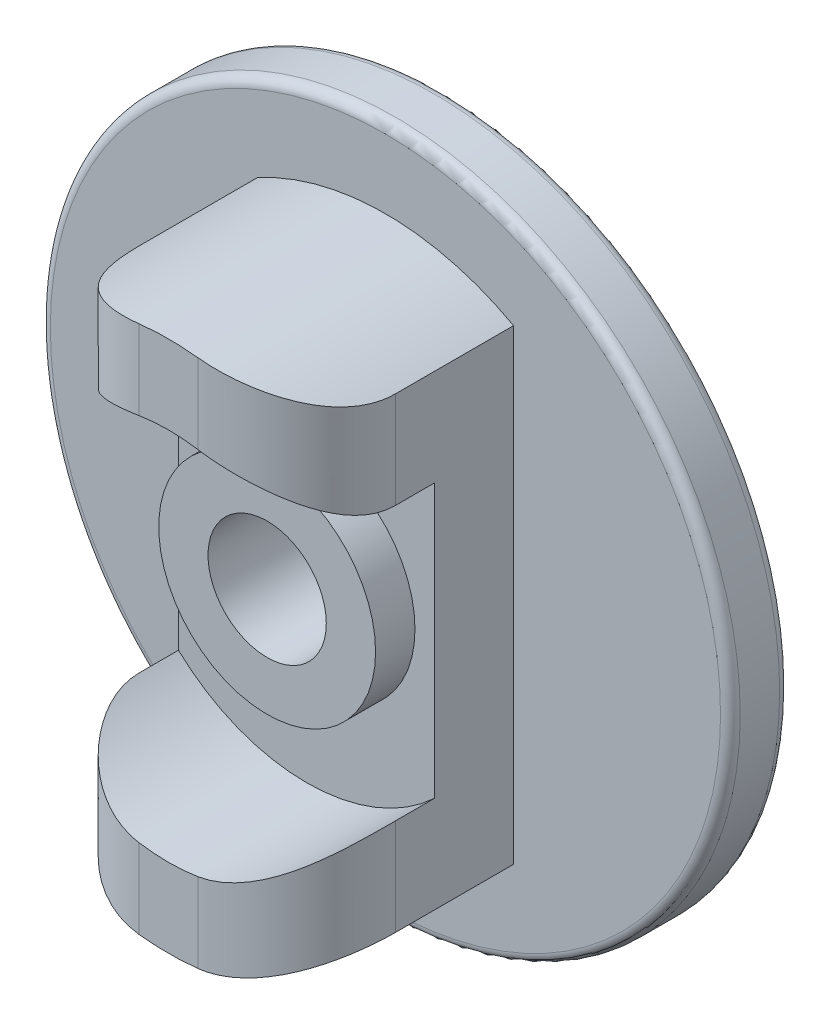
from build123d import *

# Parameters (mm, degrees)
SKETCH1_R           = 17.5
BOSS_EXTRUDE1_DEPTH = 3
SKETCH2_R           = 15.5
CUT_EXTRUDE1_DEPTH  = 1
SKETCH3_W           = 13
SKETCH3_H           = 28
BOSS_EXTRUDE2_DEPTH = 11
SKETCH4_R           = 9.5
CUT_EXTRUDE2_DEPTH  = 7
SKETCH5_R           = 16.54214052
SKETCH5_R_2         = 13.5
CUT_EXTRUDE3_DEPTH  = 11
FILLET1_R           = 5
SKETCH6_R           = 5.5
BOSS_EXTRUDE3_DEPTH = 2
SKETCH7_R           = 3
CUT_EXTRUDE4_DEPTH  = 27.334388165
FILLET3_R           = 0.5


with BuildPart() as part:
    # Sketch1 → Boss-Extrude1 (new body)
    with BuildSketch(Plane.XY):
        Circle(SKETCH1_R)
    extrude(amount=BOSS_EXTRUDE1_DEPTH)

    # Sketch2 → Cut-Extrude1 (cut)
    with BuildSketch(Plane(origin=(0, 0, 0), x_dir=(-1, 0, 0), z_dir=(0, 0, -1))):
        Circle(SKETCH2_R)
    extrude(amount=-CUT_EXTRUDE1_DEPTH, mode=Mode.SUBTRACT)

    # Sketch3 → Boss-Extrude2 (add)
    with BuildSketch(Plane.XY.offset(3)):
        Rectangle(SKETCH3_W, SKETCH3_H)
    extrude(amount=BOSS_EXTRUDE2_DEPTH)

    # Sketch4 → Cut-Extrude2 (cut)
    with BuildSketch(Plane.XY.offset(14)):
        Circle(SKETCH4_R)
    extrude(amount=-CUT_EXTRUDE2_DEPTH, mode=Mode.SUBTRACT)

    # Sketch5 → Cut-Extrude3 (cut)
    with BuildSketch(Plane.XY.offset(14)):
        Circle(SKETCH5_R)
        Circle(SKETCH5_R_2, mode=Mode.SUBTRACT)
    extrude(amount=-CUT_EXTRUDE3_DEPTH, mode=Mode.SUBTRACT)

    # Fillet1
    fillet1_edges = [part.edges().sort_by_distance(p)[0] for p in [
        (6.5, 9.380181398, 14),
        (-6.5, -9.380181398, 14),
        (6.5, -9.380181398, 14),
        (-6.5, 9.380181398, 14),
    ]]
    fillet(fillet1_edges, radius=FILLET1_R)

    # Sketch6 → Boss-Extrude3 (add)
    with BuildSketch(Plane.XY.offset(7)):
        Circle(SKETCH6_R)
    extrude(amount=BOSS_EXTRUDE3_DEPTH)

    # Sketch7 → Cut-Extrude4 (cut, through all)
    with BuildSketch(Plane.XY.offset(9)):
        Circle(SKETCH7_R)
    extrude(amount=-CUT_EXTRUDE4_DEPTH, mode=Mode.SUBTRACT)

    # Fillet3
    fillet3_edges = [part.edges().sort_by_distance(p)[0] for p in [
        (-17.5, 0, 0),
        (-17.5, 0, 3),
        (15.5, 0, 0),
    ]]
    fillet(fillet3_edges, radius=FILLET3_R)


solid = part.part
